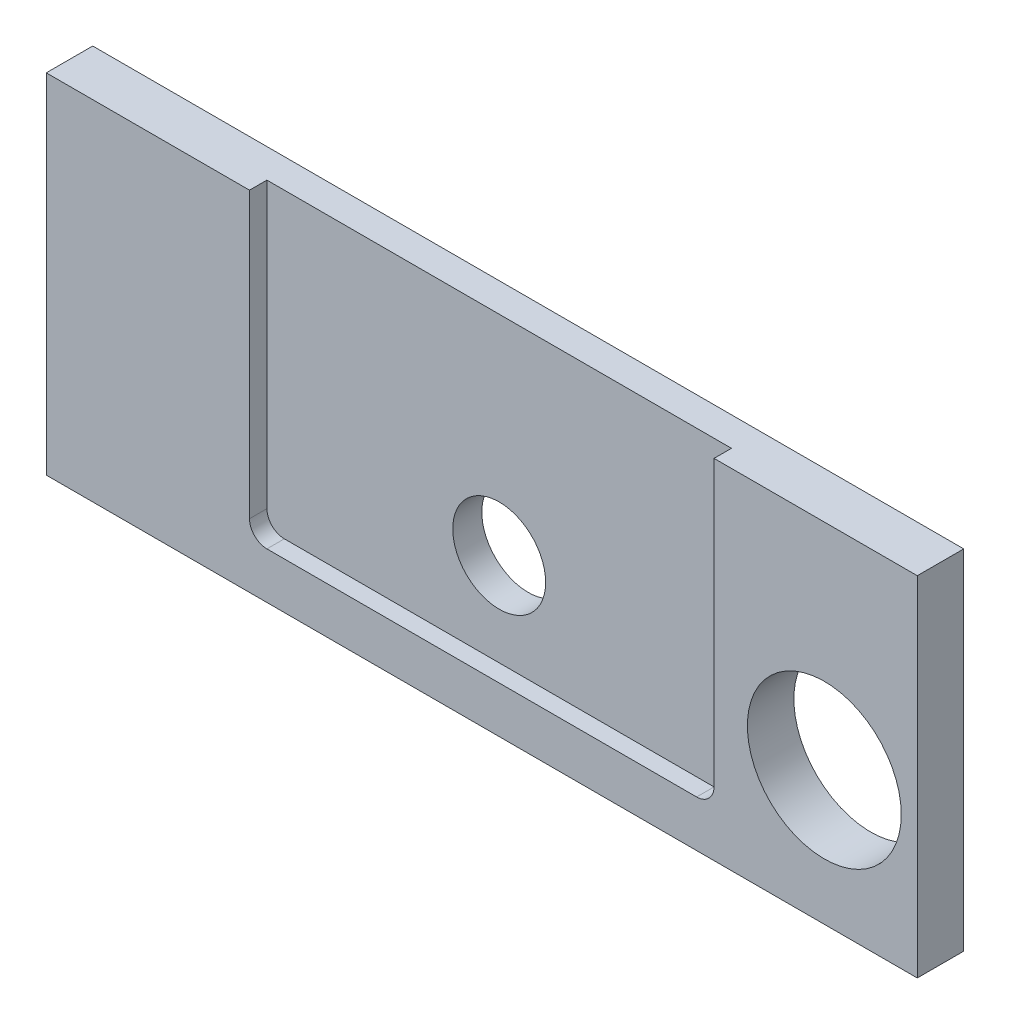
from build123d import *

# Parameters (mm, degrees)
ESQUISSE1_W                  = 150
ESQUISSE1_H                  = 60
BOSS_EXTRU_1_DEPTH           = 8
ESQUISSE2_W                  = 80
ESQUISSE2_H                  = 60
ENL_V_MAT_EXTRU_1_DEPTH      = 3
ENL_V_MAT_EXTRU_2_DEPTH      = 162.632298752
ENL_V_MAT_EXTRU_2_DEPTH_BACK = 162.632298752
ESQUISSE3_R                  = 8
ESQUISSE4_W                  = 80
ESQUISSE4_H                  = 8
BOSS_EXTRU_2_DEPTH           = 3
CONG_1_R                     = 3
ESQUISSE5_R                  = 13.25
ENL_V_MAT_EXTRU_3_DEPTH      = 162.752897965


with BuildPart() as part:
    # Esquisse1 → Boss.-Extru.1 (new body)
    with BuildSketch(Plane.XY):
        with Locations((75, 30)):
            Rectangle(ESQUISSE1_W, ESQUISSE1_H)
    extrude(amount=BOSS_EXTRU_1_DEPTH)

    # Esquisse2 → Enlèv. mat.-Extru.1 (cut)
    with BuildSketch(Plane.XY.offset(8)):
        with Locations((75, 30)):
            Rectangle(ESQUISSE2_W, ESQUISSE2_H)
    extrude(amount=-ENL_V_MAT_EXTRU_1_DEPTH, mode=Mode.SUBTRACT)

    # Esquisse3 → Enlèv. mat.-Extru.2 (cut, two sides: drawn at the far end of the back side and taken through both)
    with BuildSketch(Plane.XY.offset(5).offset(-ENL_V_MAT_EXTRU_2_DEPTH_BACK)):
        with Locations((75, 24)):
            Circle(ESQUISSE3_R)
    extrude(amount=ENL_V_MAT_EXTRU_2_DEPTH + ENL_V_MAT_EXTRU_2_DEPTH_BACK, mode=Mode.SUBTRACT)

    # Esquisse4 → Boss.-Extru.2 (add)
    with BuildSketch(Plane.XY.offset(5)):
        with Locations((75, 4)):
            Rectangle(ESQUISSE4_W, ESQUISSE4_H)
    extrude(amount=BOSS_EXTRU_2_DEPTH)

    # Congé1
    cong_1_edges = [part.edges().sort_by_distance(p)[0] for p in [
        (35, 8, 6.5),
        (115, 8, 6.5),
    ]]
    fillet(cong_1_edges, radius=CONG_1_R)

    # Esquisse5 → Enlèv. mat.-Extru.3 (cut, through all)
    with BuildSketch(Plane.XY.offset(8)):
        with Locations((133.991524815, 23)):
            Circle(ESQUISSE5_R)
    extrude(amount=-ENL_V_MAT_EXTRU_3_DEPTH, mode=Mode.SUBTRACT)


solid = part.part
